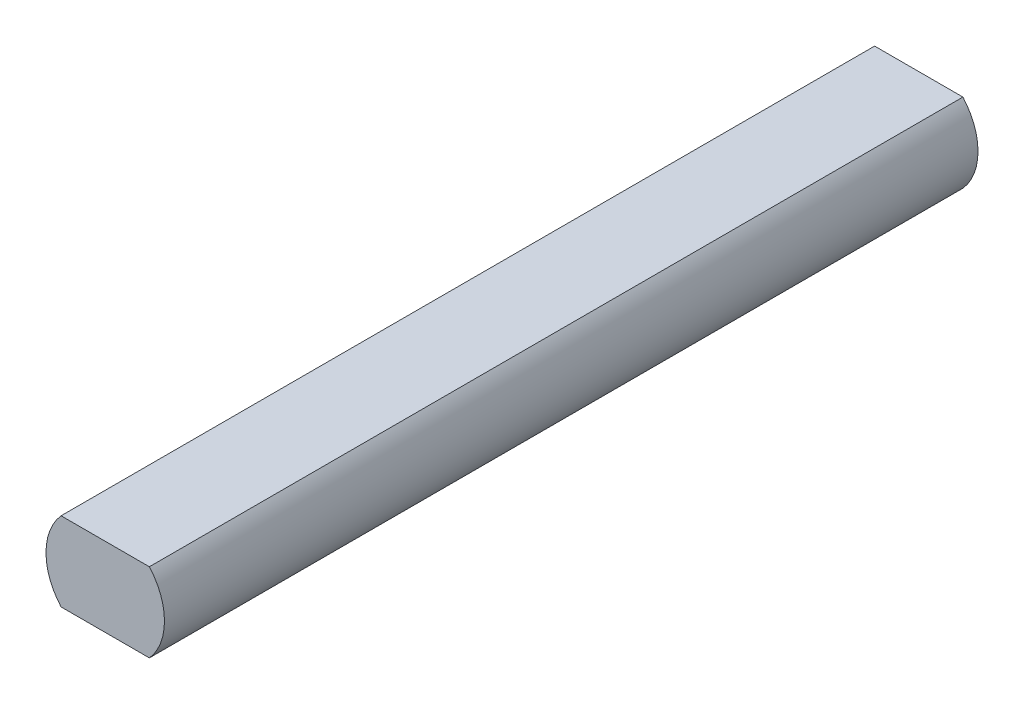
from build123d import *

# Parameters (mm, degrees)
BOSS_EXTRUDE1_DEPTH = 18.5115


with BuildPart() as part:
    # Sketch1 → Boss-Extrude1 (new, symmetric)
    with BuildSketch(Plane.XY):
        with BuildLine():
            Line((2.009232696, 1.796666667), (-2.009232696, 1.796666667))
            ThreePointArc((-2.009232696, 1.796666667), (-2.695371429, 0), (-2.009232696, -1.796666667))
            Line((-2.009232696, -1.796666667), (2.009232696, -1.796666667))
            ThreePointArc((2.009232696, -1.796666667), (2.695371429, 0), (2.009232696, 1.796666667))
        make_face()
    extrude(amount=BOSS_EXTRUDE1_DEPTH, both=True)


solid = part.part
